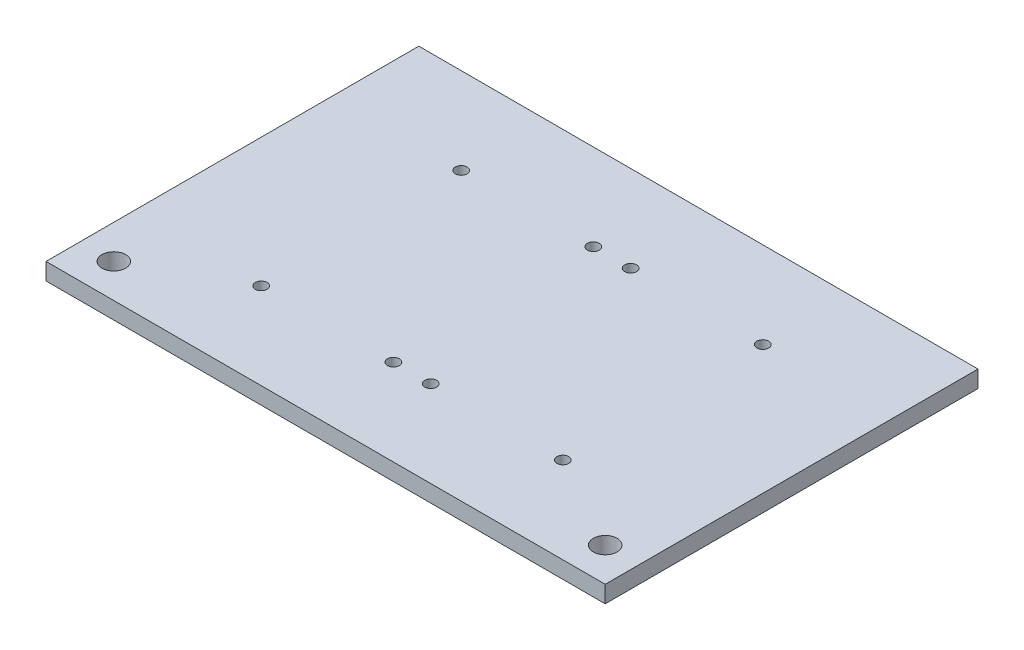
from build123d import *

# Parameters (mm, degrees)
SKETCH1_W           = 165
SKETCH1_H           = 110
SKETCH1_R           = 3.5
SKETCH1_R_2         = 1.75
BOSS_EXTRUDE1_DEPTH = 5


with BuildPart() as part:
    # Sketch1 → Boss-Extrude1 (new body)
    with BuildSketch(Plane(origin=(0, 0, 0), x_dir=(1, 0, 0), z_dir=(0, 1, 0))):
        Rectangle(SKETCH1_W, SKETCH1_H)
        with Locations(Location((72.5, -45, 0), (0, 0, 270))):
            Circle(SKETCH1_R, mode=Mode.SUBTRACT)
        with Locations(Location((-72.5, -45, 0), (0, 0, 270))):
            Circle(SKETCH1_R, mode=Mode.SUBTRACT)
        with Locations(Location((44.5, -29.5, 0), (0, 0, 270))):
            Circle(SKETCH1_R_2, mode=Mode.SUBTRACT)
        with Locations(Location((5.5, -29.5, 0), (0, 0, 270))):
            Circle(SKETCH1_R_2, mode=Mode.SUBTRACT)
        with Locations(Location((5.5, 29.5, 0), (0, 0, 270))):
            Circle(SKETCH1_R_2, mode=Mode.SUBTRACT)
        with Locations(Location((44.5, 29.5, 0), (0, 0, 270))):
            Circle(SKETCH1_R_2, mode=Mode.SUBTRACT)
        with Locations(Location((-5.5, -29.5, 0), (0, 0, 270))):
            Circle(SKETCH1_R_2, mode=Mode.SUBTRACT)
        with Locations(Location((-44.5, -29.5, 0), (0, 0, 270))):
            Circle(SKETCH1_R_2, mode=Mode.SUBTRACT)
        with Locations(Location((-44.5, 29.5, 0), (0, 0, 270))):
            Circle(SKETCH1_R_2, mode=Mode.SUBTRACT)
        with Locations(Location((-5.5, 29.5, 0), (0, 0, 270))):
            Circle(SKETCH1_R_2, mode=Mode.SUBTRACT)
    extrude(amount=BOSS_EXTRUDE1_DEPTH)


solid = part.part
